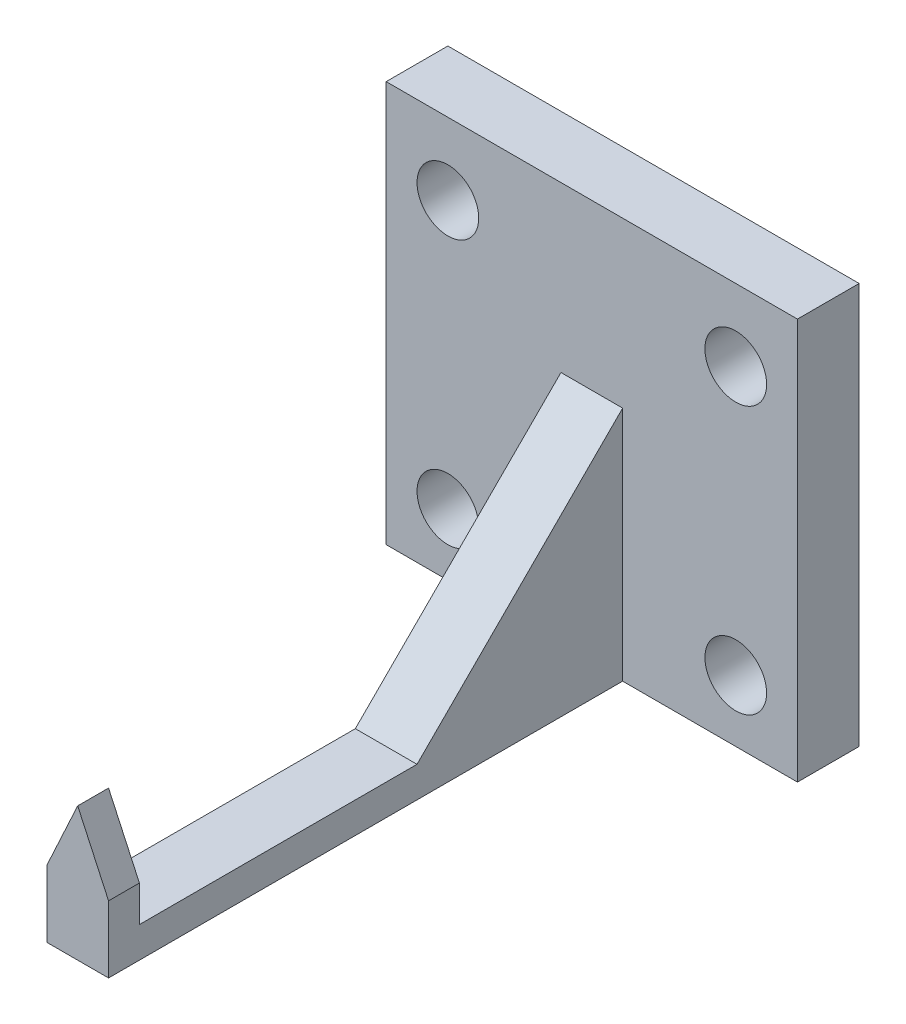
from build123d import *

# Parameters (mm, degrees)
BOSS_EXTRUDE1_DEPTH = 1.5
SKETCH2_W           = 3
SKETCH2_H           = 1.5
BOSS_EXTRUDE2_DEPTH = 5
SKETCH3_W           = 20
SKETCH3_H           = 3
BOSS_EXTRUDE3_DEPTH = 18
CUT_EXTRUDE1_DEPTH  = 10
SKETCH5_R           = 1.5
CUT_EXTRUDE4_DEPTH  = 10
BOSS_EXTRUDE4_DEPTH = 3


with BuildPart() as part:
    # Sketch1 → Boss-Extrude1 (new body)
    with BuildSketch(Plane(origin=(0, 0, 0), x_dir=(1, 0, 0), z_dir=(0, 1, 0))):
        Polygon((3, 25), (11.5, 25), (11.5, 28), (-8.5, 28), (-8.5, 25), (0, 25), (0, 0), (3, 0), align=None)
    extrude(amount=BOSS_EXTRUDE1_DEPTH)

    # Sketch2 → Boss-Extrude2 (add)
    with BuildSketch(Plane(origin=(0, 1.5, 0), x_dir=(1, 0, 0), z_dir=(0, 1, 0))):
        with Locations((1.5, 0.75)):
            Rectangle(SKETCH2_W, SKETCH2_H)
    extrude(amount=BOSS_EXTRUDE2_DEPTH)

    # Sketch3 → Boss-Extrude3 (add)
    with BuildSketch(Plane(origin=(0, 1.5, 0), x_dir=(1, 0, 0), z_dir=(0, 1, 0))):
        with Locations((1.5, 26.5)):
            Rectangle(SKETCH3_W, SKETCH3_H)
    extrude(amount=BOSS_EXTRUDE3_DEPTH)

    # Sketch4 → Cut-Extrude1 (cut)
    with BuildSketch(Plane.XY):
        Polygon((1.5, 6.5), (0, 3.25), (-1.660876249, 3.25), (-2.026223081, 8.127487576), (5.302958893, 8.676477884), (5.709427688, 3.25), (3, 3.25), align=None)
    extrude(amount=-CUT_EXTRUDE1_DEPTH, mode=Mode.SUBTRACT)

    # Sketch5 → Cut-Extrude4 (cut)
    with BuildSketch(Plane.XY.offset(-25)):
        with Locations((-5.5, 3)):
            Circle(SKETCH5_R)
        with Locations((8.5, 3)):
            Circle(SKETCH5_R)
        with Locations((8.5, 16)):
            Circle(SKETCH5_R)
        with Locations((-5.5, 16)):
            Circle(SKETCH5_R)
    extrude(amount=-CUT_EXTRUDE4_DEPTH, mode=Mode.SUBTRACT)

    # Sketch6 → Boss-Extrude4 (add)
    with BuildSketch(Plane.ZY):
        Polygon((-25, 1.5), (-25, 11.5), (-15, 1.5), align=None)
    extrude(amount=-BOSS_EXTRUDE4_DEPTH)


solid = part.part
